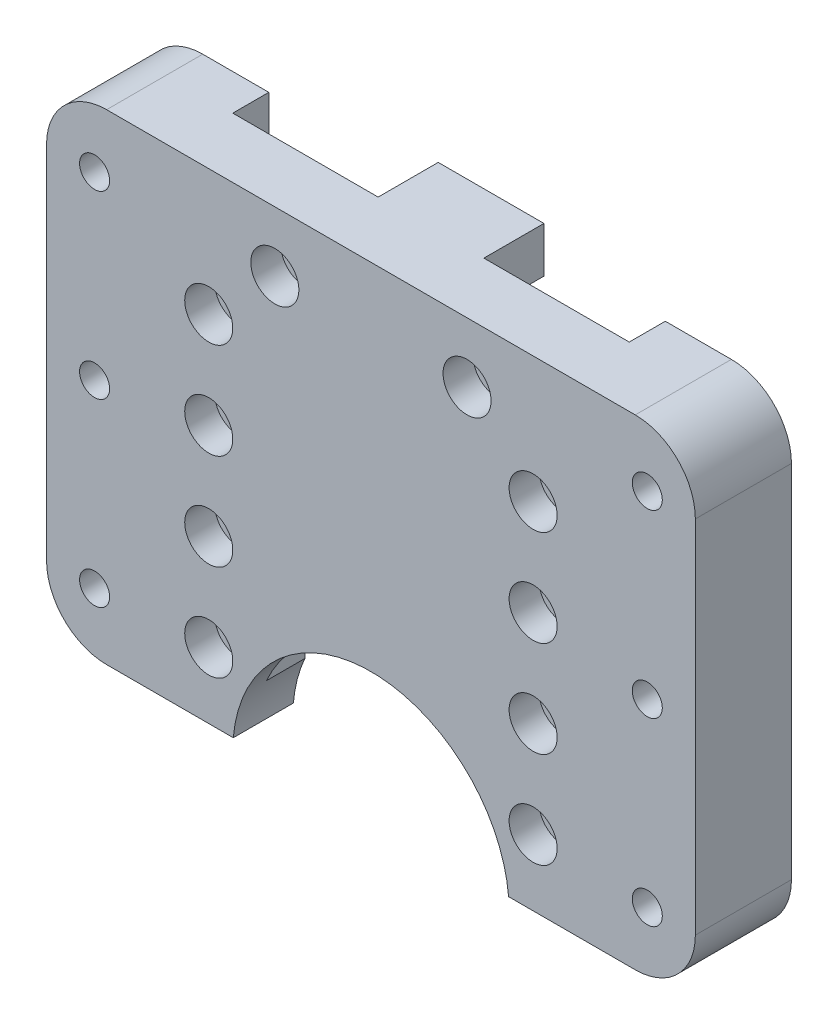
from build123d import *

# Parameters (mm, degrees)
SZKIC1_W                    = 34
SZKIC1_H                    = 40
DODANIE_WYCI_GNI_CIE1_DEPTH = 5
SZKIC2_R                    = 1.25
WYTNIJ_WYCI_GNI_CIE1_DEPTH  = 5
SZKIC3_R                    = 11.5
WYTNIJ_WYCI_GNI_CIE2_DEPTH  = 5
SZKIC4_R                    = 2
WYTNIJ_WYCI_GNI_CIE3_DEPTH  = 2.5
SZKIC5_W                    = 21
SZKIC5_H                    = 30
WYTNIJ_WYCI_GNI_CIE4_DEPTH  = 3.2
SZKIC6_W                    = 10
SZKIC6_H                    = 40
SZKIC6_R                    = 1.25
DODANIE_WYCI_GNI_CIE2_DEPTH = 5
ZAOKR_GLENIE1_R             = 5
ZAOKR_GLENIE1_OF_LUSTRO2_R  = 5
SZKIC7_W                    = 8.8
SZKIC7_H                    = 3.8
DODANIE_WYCI_GNI_CIE3_DEPTH = 5
SZKIC8_R                    = 1.25
DODANIE_WYCI_GNI_CIE4_DEPTH = 3
WYTNIJ_WYCI_GNI_CIE5_DEPTH  = 3
SZYK_LINIOWY1_COUNT         = 2
SZYK_LINIOWY1_PITCH         = 46
SZYK_LINIOWY1_COUNT_DIR2    = 3
SZYK_LINIOWY1_PITCH_DIR2    = 15
SFAZOWANIE1_SIZE            = 2


with BuildPart() as part:
    # Szkic1 → Dodanie-wyciągnięcie1 (new body)
    with BuildSketch(Plane.XY):
        Rectangle(SZKIC1_W, SZKIC1_H)
    extrude(amount=DODANIE_WYCI_GNI_CIE1_DEPTH)

    # Szkic2 → Wytnij-wyciągnięcie1 (cut)
    with BuildSketch(Plane.XY.offset(5)):
        with Locations((8, 15)):
            Circle(SZKIC2_R)
        with Locations((13.5, 9.5)):
            Circle(SZKIC2_R)
        with Locations((13.5, 1.5)):
            Circle(SZKIC2_R)
        with Locations((13.5, -6.5)):
            Circle(SZKIC2_R)
        with Locations((13.5, -14.5)):
            Circle(SZKIC2_R)
    wytnij_wyci_gni_cie1 = extrude(amount=-WYTNIJ_WYCI_GNI_CIE1_DEPTH, mode=Mode.SUBTRACT)

    # Szkic3 → Wytnij-wyciągnięcie2 (cut)
    with BuildSketch(Plane.XY.offset(5)):
        with Locations((0, -21)):
            Circle(SZKIC3_R)
    extrude(amount=-WYTNIJ_WYCI_GNI_CIE2_DEPTH, mode=Mode.SUBTRACT)

    # Szkic4 → Wytnij-wyciągnięcie3 (cut)
    with BuildSketch(Plane.XY.offset(5)):
        with Locations((8, 15)):
            Circle(SZKIC4_R)
        with Locations((13.5, 9.5)):
            Circle(SZKIC4_R)
        with Locations((13.5, 1.5)):
            Circle(SZKIC4_R)
        with Locations((13.5, -6.5)):
            Circle(SZKIC4_R)
        with Locations((13.5, -14.5)):
            Circle(SZKIC4_R)
    wytnij_wyci_gni_cie3 = extrude(amount=-WYTNIJ_WYCI_GNI_CIE3_DEPTH, mode=Mode.SUBTRACT)

    # Lustro1: Wytnij-wyciągnięcie1, Wytnij-wyciągnięcie3 across plane
    add(wytnij_wyci_gni_cie1.mirror(Plane(origin=(0, 0, 0), x_dir=(0, 0, 1), z_dir=(1, 0, 0))), mode=Mode.SUBTRACT)
    add(wytnij_wyci_gni_cie3.mirror(Plane(origin=(0, 0, 0), x_dir=(0, 0, 1), z_dir=(1, 0, 0))), mode=Mode.SUBTRACT)

    # Szkic5 → Wytnij-wyciągnięcie4 (cut)
    with BuildSketch(Plane(origin=(0, 0, 0), x_dir=(-1, 0, 0), z_dir=(0, 0, -1))):
        with Locations((0, -3)):
            Rectangle(SZKIC5_W, SZKIC5_H)
    extrude(amount=-WYTNIJ_WYCI_GNI_CIE4_DEPTH, mode=Mode.SUBTRACT)

    # Szkic6 → Dodanie-wyciągnięcie2 (add)
    with BuildSketch(Plane.XY.offset(5)):
        with Locations((-22, 0)):
            Rectangle(SZKIC6_W, SZKIC6_H)
        with Locations((-23, -15)):
            Circle(SZKIC6_R, mode=Mode.SUBTRACT)
        with Locations((-23, 0)):
            Circle(SZKIC6_R, mode=Mode.SUBTRACT)
        with Locations((-23, 15)):
            Circle(SZKIC6_R, mode=Mode.SUBTRACT)
    dodanie_wyci_gni_cie2 = extrude(amount=-DODANIE_WYCI_GNI_CIE2_DEPTH)

    # Zaokrąglenie1
    zaokr_glenie1_edges = [part.edges().sort_by_distance(p)[0] for p in [
        (-27, -20, 2.5),
        (-27, 20, 2.5),
    ]]
    fillet(zaokr_glenie1_edges, radius=ZAOKR_GLENIE1_R)

    # Lustro2: Dodanie-wyciągnięcie2 across plane
    add(dodanie_wyci_gni_cie2.mirror(Plane(origin=(0, 0, 0), x_dir=(0, 0, 1), z_dir=(1, 0, 0))))

    # Zaokrąglenie1 of Lustro2
    zaokr_glenie1_of_lustro2_edges = [part.edges().sort_by_distance(p)[0] for p in [
        (27, -20, 2.5),
        (27, 20, 2.5),
    ]]
    fillet(zaokr_glenie1_of_lustro2_edges, radius=ZAOKR_GLENIE1_OF_LUSTRO2_R)

    # Szkic7 → Dodanie-wyciągnięcie3 (add)
    with BuildSketch(Plane(origin=(0, 0, 0), x_dir=(-1, 0, 0), z_dir=(0, 0, -1))):
        with Locations((0, 18.1)):
            Rectangle(SZKIC7_W, SZKIC7_H)
    extrude(amount=DODANIE_WYCI_GNI_CIE3_DEPTH)

    # Szkic8 → Dodanie-wyciągnięcie4 (add)
    # profile 1 of 2: a face of its own
    with BuildSketch(Plane(origin=(0, 0, 0), x_dir=(-1, 0, 0), z_dir=(0, 0, -1))):
        with BuildLine():
            Line((-16.5, -20), (-16.5, 20))
            Line((-16.5, 20), (-22, 20))
            ThreePointArc((-22, 20), (-25.535533906, 18.535533906), (-27, 15))
            Line((-27, 15), (-27, -15))
            ThreePointArc((-27, -15), (-25.535533906, -18.535533906), (-22, -20))
            Line((-22, -20), (-16.5, -20))
        make_face()
        with Locations(Location((-23, -15, 0), (0, 0, 180))):
            Circle(SZKIC8_R, mode=Mode.SUBTRACT)
        with Locations(Location((-23, 0, 0), (0, 0, 180))):
            Circle(SZKIC8_R, mode=Mode.SUBTRACT)
        with Locations(Location((-23, 15, 0), (0, 0, 180))):
            Circle(SZKIC8_R, mode=Mode.SUBTRACT)
    # profile 2 of 2: a face of its own
    with BuildSketch(Plane(origin=(0, 0, 0), x_dir=(-1, 0, 0), z_dir=(0, 0, -1))):
        with BuildLine():
            Line((22, 20), (16.5, 20))
            Line((16.5, 20), (16.5, -20))
            Line((16.5, -20), (22, -20))
            ThreePointArc((22, -20), (25.535533906, -18.535533906), (27, -15))
            Line((27, -15), (27, 15))
            ThreePointArc((27, 15), (25.535533906, 18.535533906), (22, 20))
        make_face()
        with Locations(Location((23, -15, 0), (0, 0, 180))):
            Circle(SZKIC8_R, mode=Mode.SUBTRACT)
        with Locations(Location((23, 0, 0), (0, 0, 180))):
            Circle(SZKIC8_R, mode=Mode.SUBTRACT)
        with Locations(Location((23, 15, 0), (0, 0, 180))):
            Circle(SZKIC8_R, mode=Mode.SUBTRACT)
    extrude(amount=DODANIE_WYCI_GNI_CIE4_DEPTH)

    # Szkic9 → Wytnij-wyciągnięcie5 (cut)
    with BuildSketch(Plane(origin=(0, 0, -3), x_dir=(-1, 0, 0), z_dir=(0, 0, -1))):
        Polygon((-23, 12.575128869), (-20.9, 13.787564435), (-20.9, 16.212435565), (-23, 17.424871131), (-25.1, 16.212435565), (-25.1, 13.787564435), align=None)
    wytnij_wyci_gni_cie5 = extrude(amount=-WYTNIJ_WYCI_GNI_CIE5_DEPTH, mode=Mode.SUBTRACT)

    # Szyk liniowy1: Wytnij-wyci_gni_cie5 2 × 3
    with Locations(*[(-i * SZYK_LINIOWY1_PITCH, -j * SZYK_LINIOWY1_PITCH_DIR2, 0) for i in range(SZYK_LINIOWY1_COUNT) for j in range(SZYK_LINIOWY1_COUNT_DIR2) if (i, j) != (0, 0)]):
        add(wytnij_wyci_gni_cie5, mode=Mode.SUBTRACT)

    # Sfazowanie1
    sfazowanie1_edges = [part.edges().sort_by_distance(p)[0] for p in [
        (16.5, -20, -1.5),
        (-16.5, -20, -1.5),
    ]]
    chamfer(sfazowanie1_edges, length=SFAZOWANIE1_SIZE)


solid = part.part
